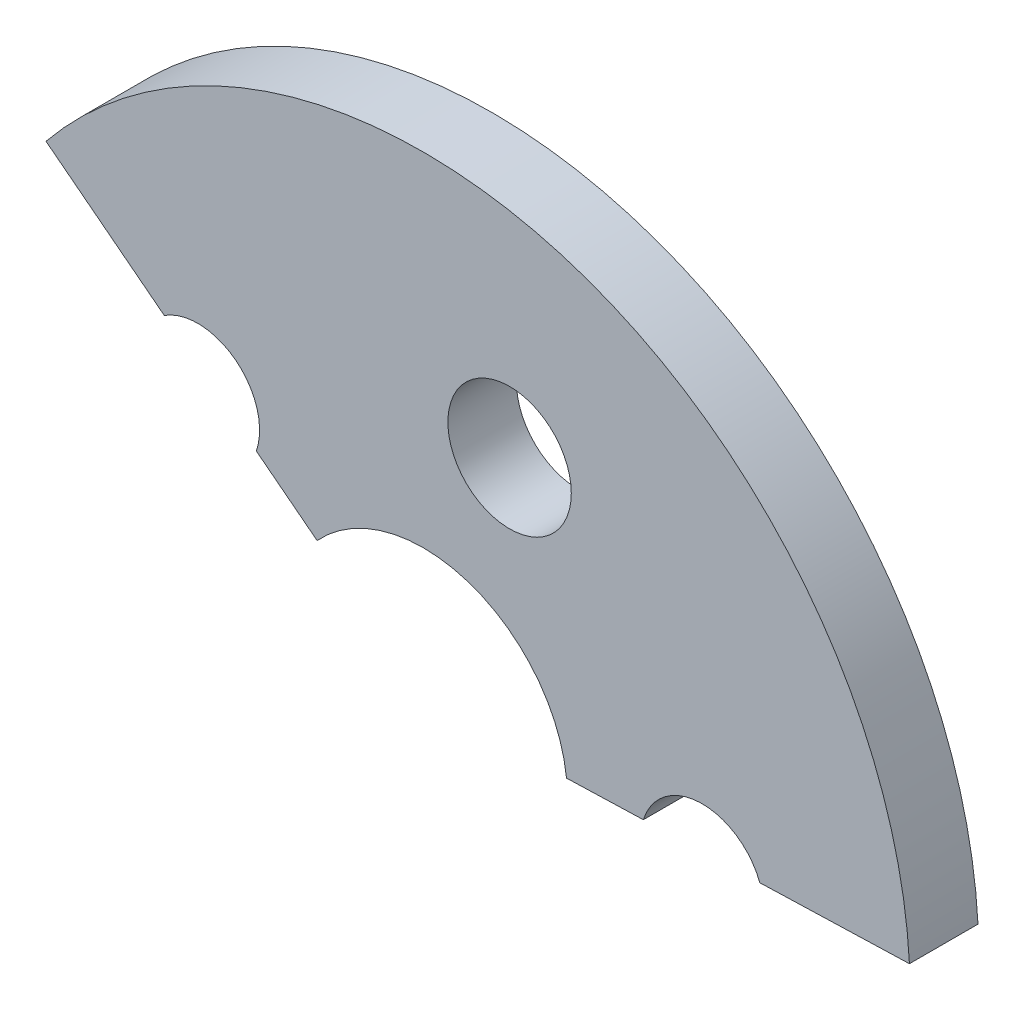
from build123d import *

# Parameters (mm, degrees)
BOSS_EXTRUDE1_DEPTH = 6.35
SKETCH15_R          = 5.715
CUT_EXTRUDE1_DEPTH  = 65.027197676


with BuildPart() as part:
    # Sketch13 → Boss-Extrude1 (new body)
    with BuildSketch(Plane.XY):
        with BuildLine():
            Line((-34.961025172, 28.467243349), (-9.847867764, 8.991202672))
            ThreePointArc((-9.847867764, 8.991202672), (4.12074162, 12.682338645), (13.251988711, 1.485604323))
            Line((13.251988711, 1.485604323), (45.016689319, 2.480908651))
            ThreePointArc((45.016689319, 2.480908651), (13.932031191, 42.878383037), (-34.961025172, 28.467243349))
        make_face()
    extrude(amount=BOSS_EXTRUDE1_DEPTH)

    # Sketch15 → Cut-Extrude1 (cut, through all)
    with BuildSketch(Plane.XY.offset(6.35)):
        with BuildLine():
            ThreePointArc((-15.475292944, 13.355447276), (-17.389315258, 19.694740336), (-24.005496972, 19.970887857))
            Line((-24.005496972, 19.970887857), (-15.475292944, 13.355447276))
        make_face()
        with Locations((7.979904528, 24.559620794)):
            Circle(SKETCH15_R)
        with BuildLine():
            ThreePointArc((31.159448366, 2.046710575), (25.644529482, 5.712196576), (20.369909931, 1.708634847))
            Line((20.369909931, 1.708634847), (31.159448366, 2.046710575))
        make_face()
    extrude(amount=-CUT_EXTRUDE1_DEPTH, mode=Mode.SUBTRACT)


solid = part.part
